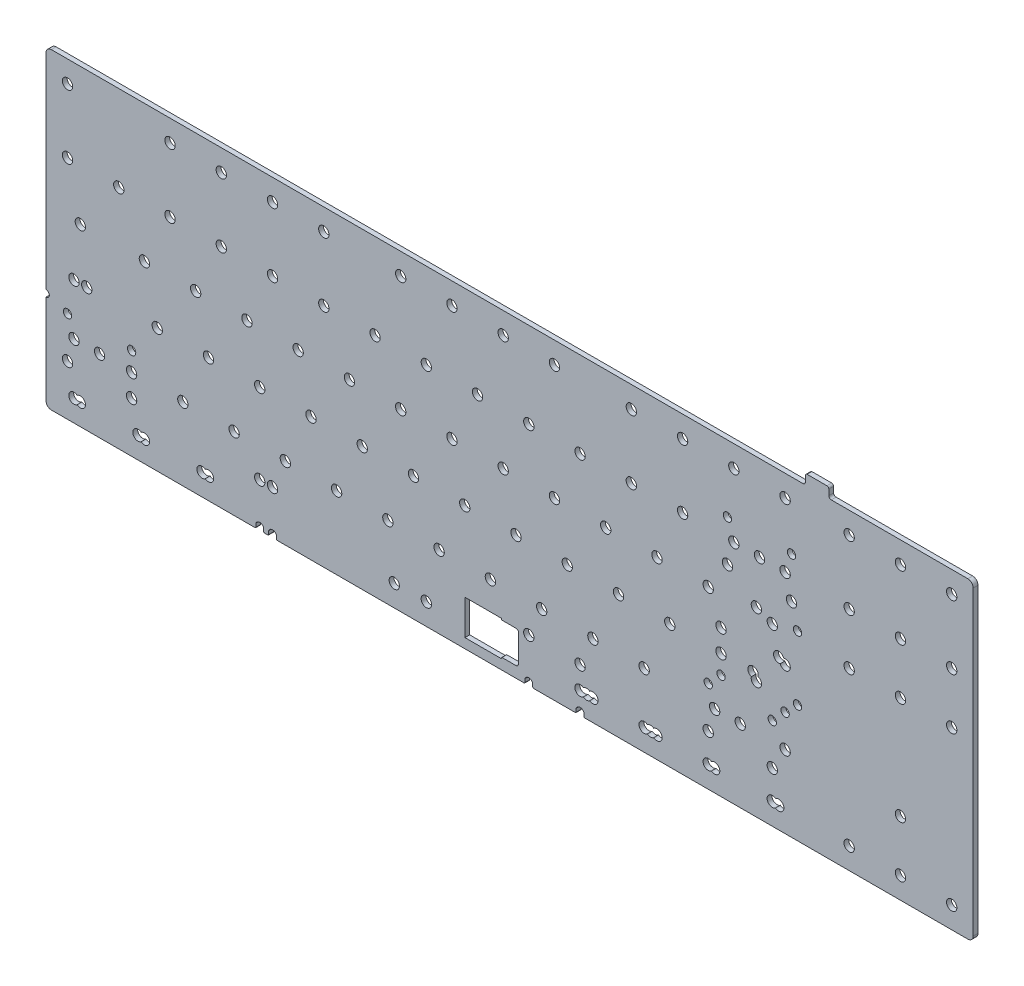
from build123d import *

# Parameters (mm, degrees)
MODEL_R             = 1.925
MODEL_R_2           = 1.55
BOSS_EXTRUDE1_DEPTH = 1.778


with BuildPart() as part:
    # Model → Boss-Extrude1 (new body)
    with BuildSketch(Plane.XY):
        with BuildLine():
            Line((273.3562, 31.8125), (-6, 31.8125))
            ThreePointArc((-6, 31.8125), (-7.414213562, 31.226713562), (-8, 29.8125))
            Line((-8, 29.8125), (-8, -46.4))
            ThreePointArc((-8, -46.4), (-7.133087086, -46.759087086), (-6.774, -47.626))
            ThreePointArc((-6.774, -47.626), (-7.1325013, -48.4914987), (-7.998, -48.85))
            Line((-7.998, -48.85), (-8, -48.85))
            Line((-8, -48.85), (-8, -82.2))
            ThreePointArc((-8, -82.2), (-7.414213562, -83.614213562), (-6, -84.2))
            Line((-6, -84.2), (69.7, -84.2))
            ThreePointArc((69.7, -84.2), (69.912132034, -84.112132034), (70, -83.9))
            Line((70, -83.9), (70, -82.626501962))
            ThreePointArc((70, -82.626501962), (71.468332201, -81.650258962), (72.9, -82.679519453))
            Line((72.9, -82.679519453), (72.9, -83.9))
            ThreePointArc((72.9, -83.9), (72.987867966, -84.112132034), (73.2, -84.2))
            Line((73.2, -84.2), (74.45, -84.2))
            ThreePointArc((74.45, -84.2), (74.662132034, -84.112132034), (74.75, -83.9))
            Line((74.75, -83.9), (74.75, -82.652277442))
            ThreePointArc((74.75, -82.652277442), (76.2, -81.65), (77.65, -82.652277442))
            Line((77.65, -82.652277442), (77.65, -83.9))
            ThreePointArc((77.65, -83.9), (77.737867966, -84.112132034), (77.95, -84.2))
            Line((77.95, -84.2), (169.7, -84.2))
            ThreePointArc((169.7, -84.2), (169.912132034, -84.112132034), (170, -83.9))
            Line((170, -83.9), (170, -82.652277442))
            ThreePointArc((170, -82.652277442), (171.45, -81.65), (172.9, -82.652277442))
            Line((172.9, -82.652277442), (172.9, -83.9))
            ThreePointArc((172.9, -83.9), (172.987867966, -84.112132034), (173.2, -84.2))
            Line((173.2, -84.2), (188.75, -84.2))
            ThreePointArc((188.75, -84.2), (188.962132034, -84.112132034), (189.05, -83.9))
            Line((189.05, -83.9), (189.05, -82.652277442))
            ThreePointArc((189.05, -82.652277442), (190.5, -81.65), (191.95, -82.652277442))
            Line((191.95, -82.652277442), (191.95, -83.9))
            ThreePointArc((191.95, -83.9), (192.037867966, -84.112132034), (192.25, -84.2))
            Line((192.25, -84.2), (334.6125, -84.2))
            ThreePointArc((334.6125, -84.2), (336.026713562, -83.614213562), (336.6125, -82.2))
            Line((336.6125, -82.2), (336.6125, 29.8125))
            ThreePointArc((336.6125, 29.8125), (336.026713562, 31.226713562), (334.6125, 31.8125))
            Line((334.6125, 31.8125), (283.8562, 31.8125))
            ThreePointArc((283.8562, 31.8125), (283.219868541, 32.07613925), (282.9563, 32.7125))
            Line((282.9563, 32.7125), (282.9563, 34.85))
            ThreePointArc((282.9563, 34.85), (282.751274747, 35.344974747), (282.2563, 35.55))
            Line((282.2563, 35.55), (274.9563, 35.55))
            ThreePointArc((274.9563, 35.55), (274.461325253, 35.344974747), (274.2563, 34.85))
            Line((274.2563, 34.85), (274.2563, 32.7125))
            ThreePointArc((274.2563, 32.7125), (273.992660749, 32.076068539), (273.3562, 31.8125))
        make_face()
        with Locations((223.8375, -38.1)):
            Circle(MODEL_R, mode=Mode.SUBTRACT)
        with Locations((176.2125, -57.15)):
            Circle(MODEL_R, mode=Mode.SUBTRACT)
        with Locations((209.55, 0)):
            Circle(MODEL_R, mode=Mode.SUBTRACT)
        with Locations((195.2625, -57.15)):
            Circle(MODEL_R, mode=Mode.SUBTRACT)
        with Locations((214.3125, -57.15)):
            Circle(MODEL_R, mode=Mode.SUBTRACT)
        with Locations((190.5, 0)):
            Circle(MODEL_R, mode=Mode.SUBTRACT)
        with Locations((19.05, 0)):
            Circle(MODEL_R, mode=Mode.SUBTRACT)
        with Locations((38.1, 0)):
            Circle(MODEL_R, mode=Mode.SUBTRACT)
        with Locations((57.15, 0)):
            Circle(MODEL_R, mode=Mode.SUBTRACT)
        with Locations((76.2, 0)):
            Circle(MODEL_R, mode=Mode.SUBTRACT)
        with Locations((95.25, 0)):
            Circle(MODEL_R, mode=Mode.SUBTRACT)
        with Locations((114.3, 0)):
            Circle(MODEL_R, mode=Mode.SUBTRACT)
        with Locations((133.35, 0)):
            Circle(MODEL_R, mode=Mode.SUBTRACT)
        with Locations((152.4, 0)):
            Circle(MODEL_R, mode=Mode.SUBTRACT)
        with Locations((171.45, 0)):
            Circle(MODEL_R, mode=Mode.SUBTRACT)
        with Locations((204.7875, -38.1)):
            Circle(MODEL_R, mode=Mode.SUBTRACT)
        with Locations((228.6, 0)):
            Circle(MODEL_R, mode=Mode.SUBTRACT)
        with Locations((33.3375, -38.1)):
            Circle(MODEL_R, mode=Mode.SUBTRACT)
        with Locations((119.0625, -57.15)):
            Circle(MODEL_R, mode=Mode.SUBTRACT)
        with Locations((266.7, 0)):
            Circle(MODEL_R, mode=Mode.SUBTRACT)
        with Locations((80.9625, -57.15)):
            Circle(MODEL_R, mode=Mode.SUBTRACT)
        with Locations((2.3813, -38.1)):
            Circle(MODEL_R, mode=Mode.SUBTRACT)
        with Locations((7.1438, -38.1)):
            Circle(MODEL_R, mode=Mode.SUBTRACT)
        with Locations((71.4375, -38.1)):
            Circle(MODEL_R, mode=Mode.SUBTRACT)
        with Locations((290.5125, -19.05)):
            Circle(MODEL_R, mode=Mode.SUBTRACT)
        with Locations((309.5625, -76.2)):
            Circle(MODEL_R, mode=Mode.SUBTRACT)
        with Locations((66.675, -19.05)):
            Circle(MODEL_R, mode=Mode.SUBTRACT)
        with Locations((309.5625, -19.05)):
            Circle(MODEL_R, mode=Mode.SUBTRACT)
        with Locations((0, 23.8125)):
            Circle(MODEL_R, mode=Mode.SUBTRACT)
        with Locations((90.4875, -38.1)):
            Circle(MODEL_R, mode=Mode.SUBTRACT)
        with Locations((38.1, 23.8125)):
            Circle(MODEL_R, mode=Mode.SUBTRACT)
        with Locations((57.15, 23.8125)):
            Circle(MODEL_R, mode=Mode.SUBTRACT)
        with Locations((76.2, 23.8125)):
            Circle(MODEL_R, mode=Mode.SUBTRACT)
        with Locations((95.25, 23.8125)):
            Circle(MODEL_R, mode=Mode.SUBTRACT)
        with Locations((123.825, 23.8125)):
            Circle(MODEL_R, mode=Mode.SUBTRACT)
        with Locations((142.875, 23.8125)):
            Circle(MODEL_R, mode=Mode.SUBTRACT)
        with Locations((161.925, 23.8125)):
            Circle(MODEL_R, mode=Mode.SUBTRACT)
        with Locations((180.975, 23.8125)):
            Circle(MODEL_R, mode=Mode.SUBTRACT)
        with Locations((209.55, 23.8125)):
            Circle(MODEL_R, mode=Mode.SUBTRACT)
        with Locations((228.6, 23.8125)):
            Circle(MODEL_R, mode=Mode.SUBTRACT)
        with Locations((247.65, 23.8125)):
            Circle(MODEL_R, mode=Mode.SUBTRACT)
        with Locations((266.7, 23.8125)):
            Circle(MODEL_R, mode=Mode.SUBTRACT)
        with Locations((266.7, -57.15)):
            Circle(MODEL_R, mode=Mode.SUBTRACT)
        with Locations((109.5375, -38.1)):
            Circle(MODEL_R, mode=Mode.SUBTRACT)
        with Locations((128.5875, -38.1)):
            Circle(MODEL_R, mode=Mode.SUBTRACT)
        with Locations((309.5625, 0)):
            Circle(MODEL_R, mode=Mode.SUBTRACT)
        with Locations((161.925, -19.05)):
            Circle(MODEL_R, mode=Mode.SUBTRACT)
        with Locations((290.5125, 0)):
            Circle(MODEL_R, mode=Mode.SUBTRACT)
        with Locations((23.8125, -57.15)):
            Circle(MODEL_R, mode=Mode.SUBTRACT)
        with Locations((147.6375, -38.1)):
            Circle(MODEL_R, mode=Mode.SUBTRACT)
        with Locations((166.6875, -38.1)):
            Circle(MODEL_R, mode=Mode.SUBTRACT)
        with Locations((185.7375, -38.1)):
            Circle(MODEL_R, mode=Mode.SUBTRACT)
        with Locations((2.3813, -57.15)):
            Circle(MODEL_R, mode=Mode.SUBTRACT)
        with Locations((290.5125, -76.2)):
            Circle(MODEL_R, mode=Mode.SUBTRACT)
        with Locations((157.1625, -57.15)):
            Circle(MODEL_R, mode=Mode.SUBTRACT)
        with Locations((247.65, 0)):
            Circle(MODEL_R, mode=Mode.SUBTRACT)
        with Locations((121.4438, -76.2)):
            Circle(MODEL_R, mode=Mode.SUBTRACT)
        with Locations((240.5063, -57.15)):
            Circle(MODEL_R, mode=Mode.SUBTRACT)
        with Locations((242.8875, -38.1)):
            Circle(MODEL_R, mode=Mode.SUBTRACT)
        with Locations((257.175, 0)):
            Circle(MODEL_R, mode=Mode.SUBTRACT)
        with Locations((11.9062, -57.15)):
            Circle(MODEL_R, mode=Mode.SUBTRACT)
        with Locations((138.1125, -57.15)):
            Circle(MODEL_R, mode=Mode.SUBTRACT)
        with Locations((180.975, -19.05)):
            Circle(MODEL_R, mode=Mode.SUBTRACT)
        with Locations((200.025, -19.05)):
            Circle(MODEL_R, mode=Mode.SUBTRACT)
        with Locations((328.6125, 23.8125)):
            Circle(MODEL_R, mode=Mode.SUBTRACT)
        with Locations((328.6125, -19.05)):
            Circle(MODEL_R, mode=Mode.SUBTRACT)
        with Locations((328.6125, 0)):
            Circle(MODEL_R, mode=Mode.SUBTRACT)
        with Locations((290.5125, 23.8125)):
            Circle(MODEL_R, mode=Mode.SUBTRACT)
        with Locations((28.575, -19.05)):
            Circle(MODEL_R, mode=Mode.SUBTRACT)
        with Locations((85.725, -19.05)):
            Circle(MODEL_R, mode=Mode.SUBTRACT)
        with Locations((250.0312, -57.15)):
            Circle(MODEL_R, mode=Mode.SUBTRACT)
        with Locations((328.6125, -76.2)):
            Circle(MODEL_R, mode=Mode.SUBTRACT)
        with Locations((52.3875, -38.1)):
            Circle(MODEL_R, mode=Mode.SUBTRACT)
        with Locations((309.5625, 23.8125)):
            Circle(MODEL_R, mode=Mode.SUBTRACT)
        with Locations((133.35, -76.2)):
            Circle(MODEL_R, mode=Mode.SUBTRACT)
        with Locations((76.2, -67.9)):
            Circle(MODEL_R, mode=Mode.SUBTRACT)
        with Locations((190.5, -67.9)):
            Circle(MODEL_R, mode=Mode.SUBTRACT)
        with Locations((71.44, -67.9)):
            Circle(MODEL_R, mode=Mode.SUBTRACT)
        with Locations((171.45, -67.9)):
            Circle(MODEL_R, mode=Mode.SUBTRACT)
        with Locations((0, -50.15)):
            Circle(MODEL_R_2, mode=Mode.SUBTRACT)
        with Locations((23.8125, -50.15)):
            Circle(MODEL_R_2, mode=Mode.SUBTRACT)
        with Locations((23.8125, -65.45)):
            Circle(MODEL_R, mode=Mode.SUBTRACT)
        with Locations((0, -65.45)):
            Circle(MODEL_R, mode=Mode.SUBTRACT)
        with Locations((245.2688, 7)):
            Circle(MODEL_R_2, mode=Mode.SUBTRACT)
        with Locations((269.0813, 7)):
            Circle(MODEL_R_2, mode=Mode.SUBTRACT)
        with Locations((269.0813, -8.3)):
            Circle(MODEL_R, mode=Mode.SUBTRACT)
        with Locations((245.2688, -8.3)):
            Circle(MODEL_R, mode=Mode.SUBTRACT)
        with Locations((266.7, -45.1)):
            Circle(MODEL_R_2, mode=Mode.SUBTRACT)
        with Locations((242.8875, -45.1)):
            Circle(MODEL_R_2, mode=Mode.SUBTRACT)
        with Locations((242.8875, -29.8)):
            Circle(MODEL_R, mode=Mode.SUBTRACT)
        with Locations((238.125, -50.15)):
            Circle(MODEL_R_2, mode=Mode.SUBTRACT)
        with Locations((261.9375, -50.15)):
            Circle(MODEL_R_2, mode=Mode.SUBTRACT)
        with Locations((261.9375, -65.45)):
            Circle(MODEL_R, mode=Mode.SUBTRACT)
        with Locations((238.125, -65.45)):
            Circle(MODEL_R, mode=Mode.SUBTRACT)
        with Locations((271.3188, -16.6687)):
            Circle(MODEL_R_2, mode=Mode.SUBTRACT)
        with Locations((271.3188, -40.4813)):
            Circle(MODEL_R_2, mode=Mode.SUBTRACT)
        with Locations((256.0188, -16.6687)):
            Circle(MODEL_R, mode=Mode.SUBTRACT)
        with Locations((104.775, -19.05)):
            Circle(MODEL_R, mode=Mode.SUBTRACT)
        with Locations((4.7625, -19.05)):
            Circle(MODEL_R, mode=Mode.SUBTRACT)
        with Locations((142.875, -19.05)):
            Circle(MODEL_R, mode=Mode.SUBTRACT)
        with Locations((309.5625, -57.15)):
            Circle(MODEL_R, mode=Mode.SUBTRACT)
        with Locations((100.0125, -57.15)):
            Circle(MODEL_R, mode=Mode.SUBTRACT)
        with Locations((47.625, -19.05)):
            Circle(MODEL_R, mode=Mode.SUBTRACT)
        with Locations((61.9125, -57.15)):
            Circle(MODEL_R, mode=Mode.SUBTRACT)
        with Locations((123.825, -19.05)):
            Circle(MODEL_R, mode=Mode.SUBTRACT)
        with Locations((42.8625, -57.15)):
            Circle(MODEL_R, mode=Mode.SUBTRACT)
        with Locations((219.075, -19.05)):
            Circle(MODEL_R, mode=Mode.SUBTRACT)
        with Locations((261.9375, -19.05)):
            Circle(MODEL_R, mode=Mode.SUBTRACT)
        with Locations((238.125, -19.05)):
            Circle(MODEL_R, mode=Mode.SUBTRACT)
        Circle(MODEL_R, mode=Mode.SUBTRACT)
        with BuildLine():
            Line((147.7, -67.6), (161.277496439, -67.6))
            ThreePointArc((161.277496439, -67.6), (161.294356415, -67.699368978), (161.3, -67.8))
            Line((161.3, -67.8), (161.3, -67.9))
            ThreePointArc((161.3, -67.9), (161.358578644, -68.041421356), (161.5, -68.1))
            Line((161.5, -68.1), (166.7, -68.1))
            ThreePointArc((166.7, -68.1), (167.336396103, -68.363603897), (167.6, -69))
            Line((167.6, -69), (167.6, -79.2))
            ThreePointArc((167.6, -79.2), (167.336396103, -79.836396103), (166.7, -80.1))
            Line((166.7, -80.1), (161.5, -80.1))
            ThreePointArc((161.5, -80.1), (161.358578644, -80.158578644), (161.3, -80.3))
            Line((161.3, -80.3), (161.3, -80.4))
            ThreePointArc((161.3, -80.4), (161.294356415, -80.500631022), (161.277496439, -80.6))
            Line((161.277496439, -80.6), (147.7, -80.6))
            Line((147.7, -80.6), (147.7, -67.6))
        make_face(mode=Mode.SUBTRACT)
        with BuildLine():
            ThreePointArc((256.636157949, -38.657980455), (253.913216669, -36.388217889), (254.176442051, -39.923319545))
            ThreePointArc((254.176442051, -39.923319545), (256.899383331, -42.193082111), (256.636157949, -38.657980455))
        make_face(mode=Mode.SUBTRACT)
        with BuildLine():
            ThreePointArc((51.1969, -74.687354424), (48.0813, -76.2), (51.1969, -77.712645576))
            ThreePointArc((51.1969, -77.712645576), (54.3125, -76.2), (51.1969, -74.687354424))
        make_face(mode=Mode.SUBTRACT)
        with BuildLine():
            ThreePointArc((3.5719, -74.687354424), (0.4563, -76.2), (3.5719, -77.712645576))
            ThreePointArc((3.5719, -77.712645576), (6.6875, -76.2), (3.5719, -74.687354424))
        make_face(mode=Mode.SUBTRACT)
        with BuildLine():
            ThreePointArc((27.3844, -74.687354424), (24.2688, -76.2), (27.3844, -77.712645576))
            ThreePointArc((27.3844, -77.712645576), (30.5, -76.2), (27.3844, -74.687354424))
        make_face(mode=Mode.SUBTRACT)
        with BuildLine():
            ThreePointArc((239.31565, -74.68739378), (236.2, -76.2), (239.31565, -77.71260622))
            ThreePointArc((239.31565, -77.71260622), (242.4313, -76.2), (239.31565, -74.68739378))
        make_face(mode=Mode.SUBTRACT)
        with BuildLine():
            ThreePointArc((266.142110245, -27.957614584), (262.607032932, -27.694387427), (264.876689755, -30.417385416))
            ThreePointArc((264.876689755, -30.417385416), (268.411767068, -30.680612573), (266.142110245, -27.957614584))
        make_face(mode=Mode.SUBTRACT)
        with BuildLine():
            ThreePointArc((191.69065, -74.68739378), (188.575, -76.2), (191.69065, -77.71260622))
            ThreePointArc((191.69065, -77.71260622), (192.881268184, -78.125), (194.0719, -77.712645576))
            ThreePointArc((194.0719, -77.712645576), (197.1875, -76.2), (194.0719, -74.687354424))
            ThreePointArc((194.0719, -74.687354424), (192.881268184, -74.275), (191.69065, -74.68739378))
        make_face(mode=Mode.SUBTRACT)
        with BuildLine():
            ThreePointArc((263.12815, -74.68739378), (260.0125, -76.2), (263.12815, -77.71260622))
            ThreePointArc((263.12815, -77.71260622), (266.2438, -76.2), (263.12815, -74.68739378))
        make_face(mode=Mode.SUBTRACT)
        with BuildLine():
            ThreePointArc((215.50315, -74.68739378), (212.3875, -76.2), (215.50315, -77.71260622))
            ThreePointArc((215.50315, -77.71260622), (216.693768184, -78.125), (217.8844, -77.712645576))
            ThreePointArc((217.8844, -77.712645576), (221, -76.2), (217.8844, -74.687354424))
            ThreePointArc((217.8844, -74.687354424), (216.693768184, -74.275), (215.50315, -74.68739378))
        make_face(mode=Mode.SUBTRACT)
    extrude(amount=BOSS_EXTRUDE1_DEPTH)


solid = part.part
